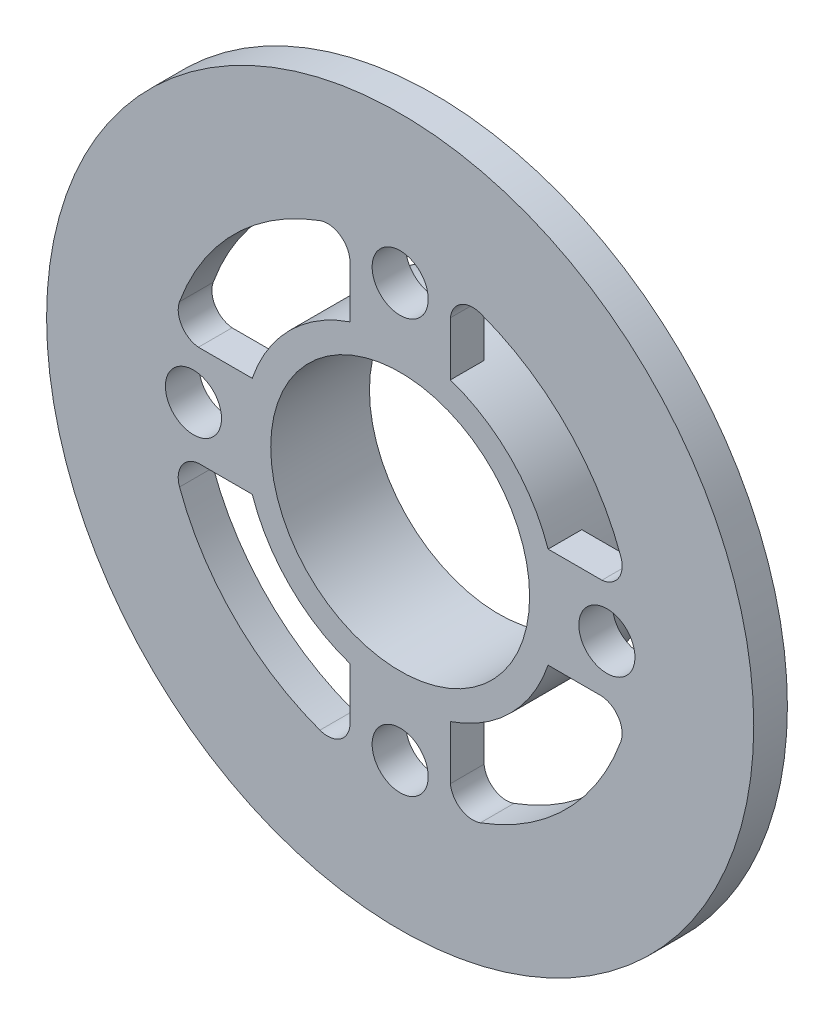
from build123d import *

# Parameters (mm, degrees)
SKETCH2_R                = 52.5
SKETCH2_R_2              = 4.1
BOSS_EXTRUDE1_DEPTH      = 3
SKETCH3_R                = 20.925
CUT_EXTRUDE1_DEPTH       = 9
SKETCH4_R                = 4.5
SKETCH4_R_2              = 2.5
BOSS_EXTRUDE2_DEPTH      = 3
FILLET1_R                = 2
SKETCH5_R                = 52.5
SKETCH5_R_2              = 31.515813439
CUT_EXTRUDE2_DEPTH       = 11.8
BOSS_EXTRUDE3_DEPTH      = 5.8
BOSS_EXTRUDE3_DEPTH_BACK = 3
SKETCH6_R                = 13.925
SKETCH6_R_2              = 11.537787208
BOSS_EXTRUDE4_DEPTH      = 3


with BuildPart() as part:
    # Sketch2 → Boss-Extrude1 (new body)
    with BuildSketch(Plane.XY):
        Circle(SKETCH2_R)
        with Locations((0, 44)):
            Circle(SKETCH2_R_2, mode=Mode.SUBTRACT)
        with Locations((38.105117767, -22)):
            Circle(SKETCH2_R_2, mode=Mode.SUBTRACT)
        with Locations((-38.105117767, -22)):
            Circle(SKETCH2_R_2, mode=Mode.SUBTRACT)
        Polygon((0, 20.207259422), (-17.5, 10.103629711), (-17.5, -10.103629711), (0, -20.207259422), (17.5, -10.103629711), (17.5, 10.103629711), align=None, mode=Mode.SUBTRACT)
    extrude(amount=BOSS_EXTRUDE1_DEPTH)

    # Sketch3 → Cut-Extrude1 (cut)
    with BuildSketch(Plane(origin=(0, 0, 0), x_dir=(-1, 0, 0), z_dir=(0, 0, -1))):
        Circle(SKETCH3_R)
    extrude(amount=-CUT_EXTRUDE1_DEPTH, mode=Mode.SUBTRACT)

    # Sketch4 → Boss-Extrude2 (add)
    # profile 1 of 4: a face of its own
    with BuildSketch(Plane(origin=(0, 0, 0), x_dir=(-1, 0, 0), z_dir=(0, 0, -1))):
        with Locations((0, 18.425)):
            Circle(SKETCH4_R)
        with Locations((0, 18.425)):
            Circle(SKETCH4_R_2, mode=Mode.SUBTRACT)
    # profile 2 of 4: a face of its own
    with BuildSketch(Plane(origin=(0, 0, 0), x_dir=(-1, 0, 0), z_dir=(0, 0, -1))):
        with Locations((-18.425, 0)):
            Circle(SKETCH4_R)
        with Locations((-18.425, 0)):
            Circle(SKETCH4_R_2, mode=Mode.SUBTRACT)
    # profile 3 of 4: a face of its own
    with BuildSketch(Plane(origin=(0, 0, 0), x_dir=(-1, 0, 0), z_dir=(0, 0, -1))):
        with Locations((0, -18.425)):
            Circle(SKETCH4_R)
        with Locations(Location((0, -18.425, 0), (0, 0, 180))):
            Circle(SKETCH4_R_2, mode=Mode.SUBTRACT)
    # profile 4 of 4: a face of its own
    with BuildSketch(Plane(origin=(0, 0, 0), x_dir=(-1, 0, 0), z_dir=(0, 0, -1))):
        with Locations((18.425, 0)):
            Circle(SKETCH4_R)
        with Locations(Location((18.425, 0, 0), (0, 0, 180))):
            Circle(SKETCH4_R_2, mode=Mode.SUBTRACT)
    extrude(amount=-BOSS_EXTRUDE2_DEPTH)

    # Fillet1
    fillet1_edges = [part.edges().sort_by_distance(p)[0] for p in [
        (-3.969288955, 20.545081411, 1.5),
        (3.969288955, 20.545081411, 1.5),
        (20.545081411, 3.969288955, 1.5),
        (20.545081411, -3.969288955, 1.5),
        (3.969288955, -20.545081411, 1.5),
        (-3.969288955, -20.545081411, 1.5),
        (-20.545081411, -3.969288955, 1.5),
        (-20.545081411, 3.969288955, 1.5),
    ]]
    fillet(fillet1_edges, radius=FILLET1_R)

    # Sketch5 → Cut-Extrude2 (cut)
    with BuildSketch(Plane(origin=(0, 0, 0), x_dir=(-1, 0, 0), z_dir=(0, 0, -1))):
        Circle(SKETCH5_R)
        Circle(SKETCH5_R_2, mode=Mode.SUBTRACT)
    extrude(amount=-CUT_EXTRUDE2_DEPTH, mode=Mode.SUBTRACT)



with BuildPart() as body_2:
    # Sketch6 → Boss-Extrude3 (new, two sides: drawn at the far end of the back side and taken through both)
    with BuildSketch(Plane(origin=(0, 0, 0), x_dir=(-1, 0, 0), z_dir=(0, 0, -1)).offset(-BOSS_EXTRUDE3_DEPTH_BACK)):
        Circle(SKETCH6_R)
        Circle(SKETCH6_R_2, mode=Mode.SUBTRACT)
    extrude(amount=BOSS_EXTRUDE3_DEPTH + BOSS_EXTRUDE3_DEPTH_BACK)


with BuildPart() as part_1:
    add(part.part)

    add(body_2.part)  # Boss-Extrude4 merges body 2
    # Sketch7 → Boss-Extrude4 (add)
    with BuildSketch(Plane.XY.offset(3)):
        Polygon((17.982092162, 4.478150583), (13.185286965, 4.478150583), (13.185286965, -4.478150583), (17.982092162, -4.478150583), (17.982092162, -3.600432721), (16.459783373, -2.648989728), (15.103112387, -1.801070362), (15.103112387, 0.78355996), (16.060382876, 2.315192743), (17.5, 3.192690691), align=None)
        Polygon((4.478150583, -17.982092162), (4.478150583, -13.185286965), (-4.478150583, -13.185286965), (-4.478150583, -17.982092162), (-3.600432721, -17.982092162), (-2.648989728, -16.459783373), (-1.801070362, -15.103112387), (0.78355996, -15.103112387), (2.315192743, -16.060382876), (3.192690691, -17.5), align=None)
        Polygon((-17.982092162, -4.478150583), (-13.185286965, -4.478150583), (-13.185286965, 4.478150583), (-17.982092162, 4.478150583), (-17.982092162, 3.600432721), (-16.459783373, 2.648989728), (-15.103112387, 1.801070362), (-15.103112387, -0.78355996), (-16.060382876, -2.315192743), (-17.5, -3.192690691), align=None)
        Polygon((-4.478150583, 17.982092162), (-4.478150583, 13.185286965), (4.478150583, 13.185286965), (4.478150583, 17.982092162), (3.600432721, 17.982092162), (2.648989728, 16.459783373), (1.801070362, 15.103112387), (-0.78355996, 15.103112387), (-2.315192743, 16.060382876), (-3.192690691, 17.5), align=None)
    extrude(amount=-BOSS_EXTRUDE4_DEPTH)


solid = part_1.part
